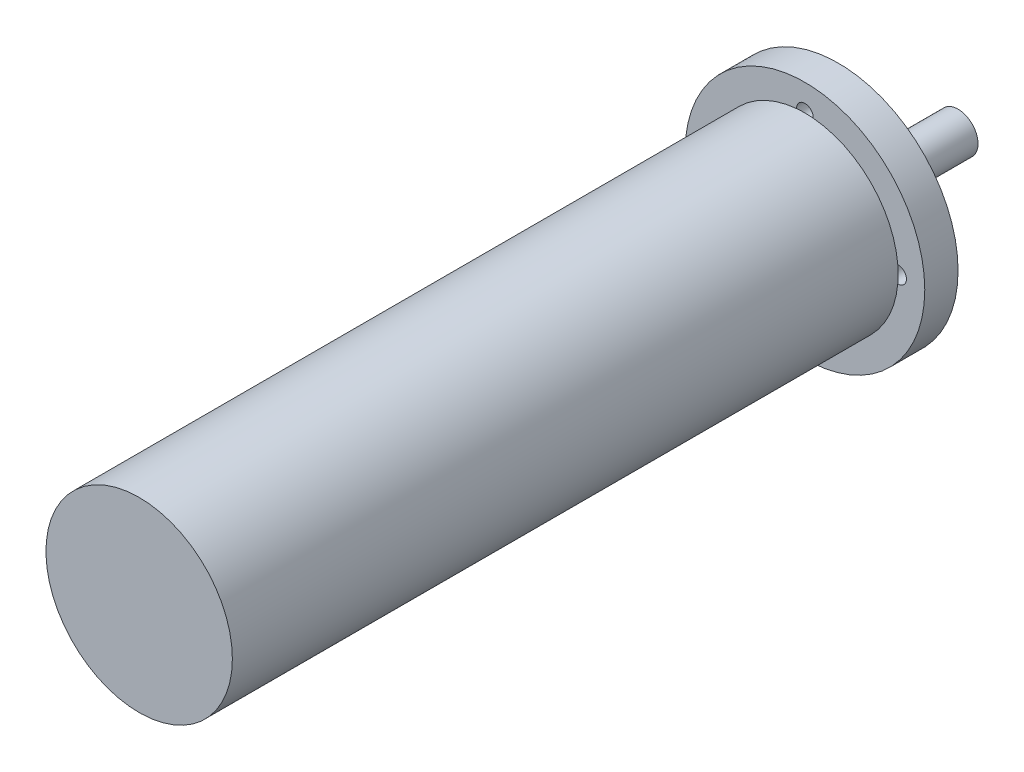
from build123d import *

# Parameters (mm, degrees)
SKETCH1_R                 = 14
BOSS_EXTRUDE1_DEPTH       = 100
SKETCH2_R                 = 11
SKETCH2_R_2               = 3
BOSS_EXTRUDE2_DEPTH       = 7
SKETCH2_3_R               = 3
BOSS_EXTRUDE3_DEPTH       = 23
BOSS_EXTRUDE4_START       = 5
SKETCH2_4_R               = 18
SKETCH2_4_R_2             = 14
SKETCH2_4_R_3             = 11
BOSS_EXTRUDE4_DEPTH       = 5
M3X0_5_TAPPED_HOLE1_D     = 2.5
M3X0_5_TAPPED_HOLE1_DEPTH = 5


with BuildPart() as part:
    # Sketch1 → Boss-Extrude1 (new body)
    with BuildSketch(Plane.XY):
        Circle(SKETCH1_R)
    extrude(amount=BOSS_EXTRUDE1_DEPTH)

    # Sketch2 → Boss-Extrude2 (add)
    # profile 1 of 2: a face of its own
    with BuildSketch(Plane(origin=(0, 0, 0), x_dir=(-1, 0, 0), z_dir=(0, 0, -1))):
        Circle(SKETCH2_R)
        Circle(SKETCH2_R_2, mode=Mode.SUBTRACT)
    # profile 2 of 2: a face of its own
    with BuildSketch(Plane(origin=(0, 0, 0), x_dir=(-1, 0, 0), z_dir=(0, 0, -1))):
        Circle(SKETCH2_R_2)
    extrude(amount=BOSS_EXTRUDE2_DEPTH)

    # Sketch2<3> → Boss-Extrude3 (add)
    with BuildSketch(Plane(origin=(0, 0, 0), x_dir=(-1, 0, 0), z_dir=(0, 0, -1))):
        Circle(SKETCH2_3_R)
    extrude(amount=BOSS_EXTRUDE3_DEPTH)

    # Sketch2<4> → Boss-Extrude4 (add)
    # profile 1 of 2: a face of its own
    with BuildSketch(Plane(origin=(0, 0, 0), x_dir=(-1, 0, 0), z_dir=(0, 0, -1)).offset(BOSS_EXTRUDE4_START)):
        Circle(SKETCH2_4_R)
        Circle(SKETCH2_4_R_2, mode=Mode.SUBTRACT)
    # profile 2 of 2: a face of its own
    with BuildSketch(Plane(origin=(0, 0, 0), x_dir=(-1, 0, 0), z_dir=(0, 0, -1)).offset(BOSS_EXTRUDE4_START)):
        Circle(SKETCH2_4_R_2)
        Circle(SKETCH2_4_R_3, mode=Mode.SUBTRACT)
    extrude(amount=-BOSS_EXTRUDE4_DEPTH)

    # M3x0.5 Tapped Hole1
    with Locations(Plane(origin=(0, 0, -5), x_dir=(-1, 0, 0), z_dir=(0, 0, -1))):
        with Locations((0, 14), (14, 0), (0, -14), (-14, 0)):
            Hole(M3X0_5_TAPPED_HOLE1_D / 2, depth=M3X0_5_TAPPED_HOLE1_DEPTH)


solid = part.part
